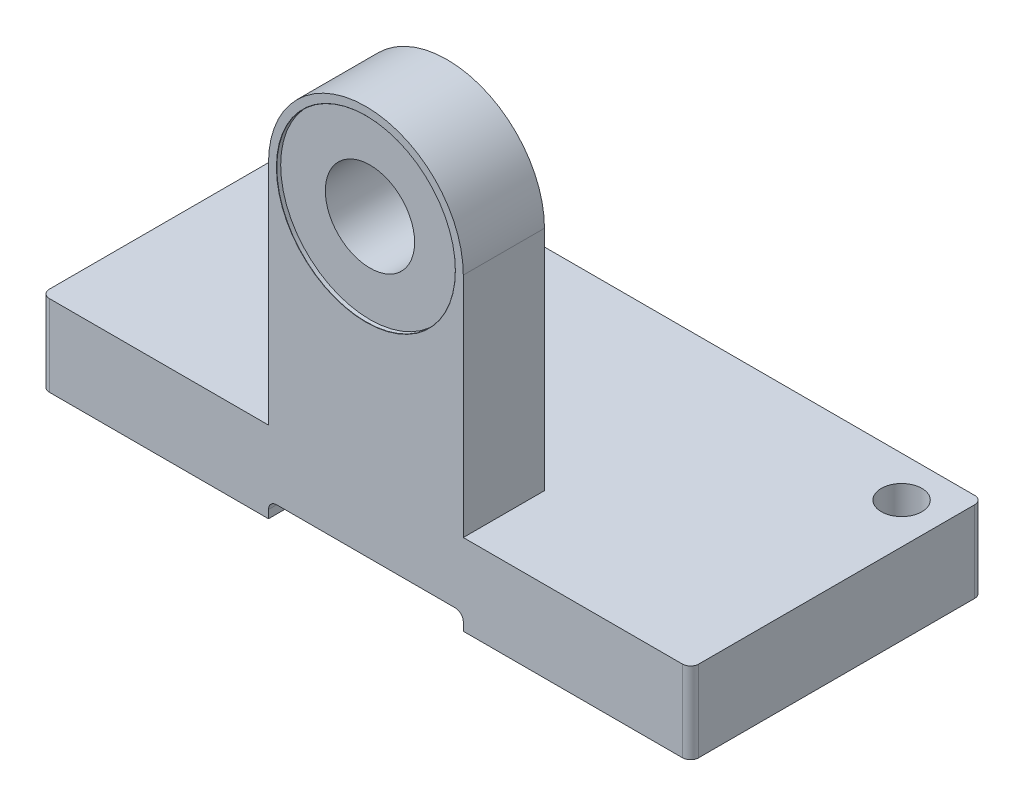
from build123d import *

# Parameters (mm, degrees)
SKETCH_1_W          = 80
SKETCH_1_H          = 10
EXTRUDE_1_DEPTH     = 36
EXTRUDE_3_DEPTH     = 10
FILLET_1_RADIUS     = 12
FILLET_1_LENGTH     = 10
SKETCH_3_W          = 24
SKETCH_3_H          = 2
CUT_EXTRUDE_1_DEPTH = 97.415766346
SKETCH_6_R          = 2.5
CUT_EXTRUDE_2_DEPTH = 97.415766346
FILLET_2_R          = 1


with BuildPart() as part:
    # 草图1 → 凸台-拉伸1 (new body)
    with BuildSketch(Plane.XY):
        with Locations((40, -5)):
            Rectangle(SKETCH_1_W, SKETCH_1_H)
    extrude(amount=-EXTRUDE_1_DEPTH)

    # 草图2 → 凸台-拉伸3 (add)
    with BuildSketch(Plane.XY):
        Polygon((28, 0), (28, 40), (52, 40), (52, 0), (80, 0), (80, -10), (0, -10), (0, 0), align=None)
    extrude(amount=-EXTRUDE_3_DEPTH)

    # 圆角1: full round fillet: the end face becomes a half cylinder, R = half its width
    fillet_1_face = Plane((40, 40, -5), x_dir=(0, 0, 1), z_dir=(0, 1, 0))  # on the end face: x along it, z out of the body
    fillet_1_slab = fillet_1_face.offset(-FILLET_1_RADIUS / 2) * Box(FILLET_1_LENGTH, 2 * FILLET_1_RADIUS, FILLET_1_RADIUS, mode=Mode.PRIVATE)  # the body's end, R deep
    fillet_1_round = Plane((40, 28, -5), x_dir=(0, 1, 0), z_dir=(0, 0, 1)) * Cylinder(FILLET_1_RADIUS, FILLET_1_LENGTH, mode=Mode.PRIVATE)  # its axis R under the face
    add(fillet_1_slab - fillet_1_round, mode=Mode.SUBTRACT)

    # 草图3 → 切除-拉伸1 (cut, through all)
    with BuildSketch(Plane.XY):
        with Locations((40, -9)):
            Rectangle(SKETCH_3_W, SKETCH_3_H)
    extrude(amount=-CUT_EXTRUDE_1_DEPTH, mode=Mode.SUBTRACT)

    # 草图5 → M10 六角头螺栓C级的柱形沉头孔1 (revolve, cut)
    with BuildSketch(Plane(origin=(40, 28, 0), x_dir=(0, -1, 0), z_dir=(1, 0, 0))):
        Polygon((0, 0), (0, 36), (5.5, 36), (5.5, 0.5), (11, 0.5), (11, 0.020977491), (11.025, 0), align=None)
    revolve(axis=Axis((40, 28, 6.35), (0, 0, -1)), mode=Mode.SUBTRACT)

    # 草图6 → 切除-拉伸2 (cut, through all)
    with BuildSketch(Plane(origin=(0, 0, 0), x_dir=(1, 0, 0), z_dir=(0, 1, 0))):
        with Locations(Location((75, 31, 0), (0, 0, 270))):
            Circle(SKETCH_6_R)
        with Locations(Location((5, 31, 0), (0, 0, 270))):
            Circle(SKETCH_6_R)
    extrude(amount=-CUT_EXTRUDE_2_DEPTH, mode=Mode.SUBTRACT)

    # 圆角2
    fillet_2_edges = [part.edges().sort_by_distance(p)[0] for p in [
        (80, -5, -36),
        (0, -5, -36),
        (80, -5, 0),
        (28, -8, -18),
        (52, -8, -18),
        (0, -5, 0),
    ]]
    fillet(fillet_2_edges, radius=FILLET_2_R)


solid = part.part
